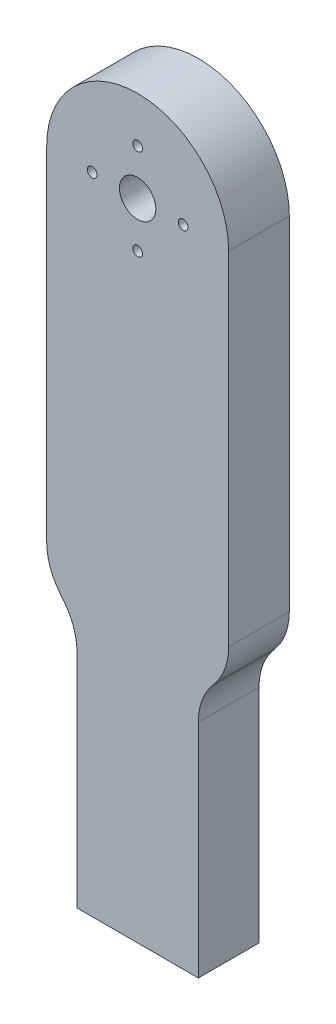
from build123d import *

# Parameters (mm, degrees)
ESQUISSE1_R        = 0.8
ESQUISSE1_R_2      = 3
BOSS_EXTRU_1_DEPTH = 5


with BuildPart() as part:
    # Esquisse1 → Boss.-Extru.1 (new, symmetric)
    with BuildSketch(Plane.XY):
        with BuildLine():
            Line((-15, 13.5), (-15, -43.010256567))
            ThreePointArc((-15, -43.010256567), (-14.441599081, -46.305132406), (-12.828758641, -49.232035906))
            Line((-12.828758641, -49.232035906), (-12.171241359, -50.059378669))
            ThreePointArc((-12.171241359, -50.059378669), (-10.558400919, -52.986282168), (-10, -56.281158007))
            Line((-10, -56.281158007), (-10, -92.791414574))
            Line((-10, -92.791414574), (10, -92.791414574))
            Line((10, -92.791414574), (10, -56.281158007))
            ThreePointArc((10, -56.281158007), (10.558400919, -52.986282168), (12.171241359, -50.059378669))
            Line((12.171241359, -50.059378669), (12.828758641, -49.232035906))
            ThreePointArc((12.828758641, -49.232035906), (14.441599081, -46.305132406), (15, -43.010256567))
            Line((15, -43.010256567), (15, 13.5))
            ThreePointArc((15, 13.5), (0, 28.5), (-15, 13.5))
        make_face()
        with Locations((-0.005270268, 5.998754805)):
            Circle(ESQUISSE1_R, mode=Mode.SUBTRACT)
        with Locations((-7.505270268, 13.498754805)):
            Circle(ESQUISSE1_R, mode=Mode.SUBTRACT)
        with Locations((-0.005270268, 20.998754805)):
            Circle(ESQUISSE1_R, mode=Mode.SUBTRACT)
        with Locations((7.494729732, 13.498754805)):
            Circle(ESQUISSE1_R, mode=Mode.SUBTRACT)
        with Locations((-0.005270268, 13.498754805)):
            Circle(ESQUISSE1_R_2, mode=Mode.SUBTRACT)
    extrude(amount=BOSS_EXTRU_1_DEPTH, both=True)


solid = part.part
